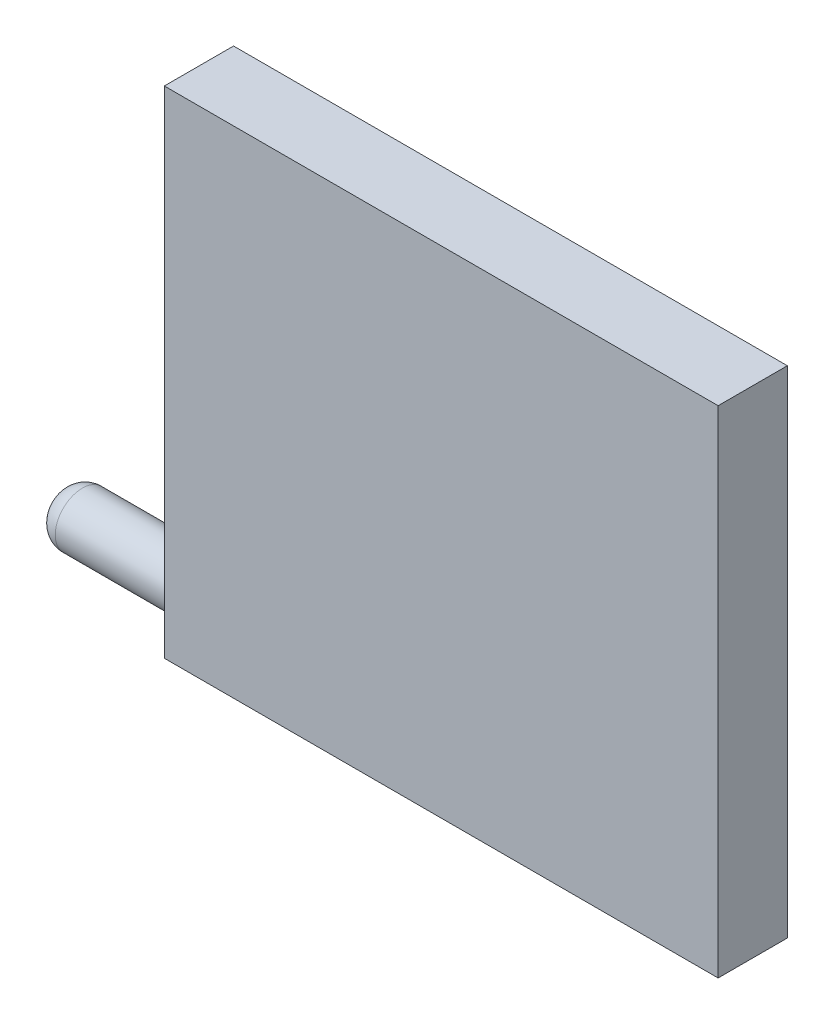
from build123d import *

# Parameters (mm, degrees)
SKETCH1_W           = 80
SKETCH1_H           = 71.597374179
BOSS_EXTRUDE1_DEPTH = 10
SKETCH2_R           = 3.909711409
BOSS_EXTRUDE2_DEPTH = 20
FILLET1_R           = 3


with BuildPart() as part:
    # Sketch1 → Boss-Extrude1 (new body)
    with BuildSketch(Plane.XY):
        with Locations((40, -35.798687089)):
            Rectangle(SKETCH1_W, SKETCH1_H)
    extrude(amount=BOSS_EXTRUDE1_DEPTH)

    # Sketch2 → Boss-Extrude2 (add)
    with BuildSketch(Plane.ZY):
        with Locations(Location((4.849229458, -65.299456518, 0), (0, 0, 180))):
            Circle(SKETCH2_R)
    extrude(amount=BOSS_EXTRUDE2_DEPTH)

    # Fillet1
    fillet1_edges = [part.edges().sort_by_distance(p)[0] for p in [
        (-20, -65.299456518, 8.758940867),
    ]]
    fillet(fillet1_edges, radius=FILLET1_R)


solid = part.part
